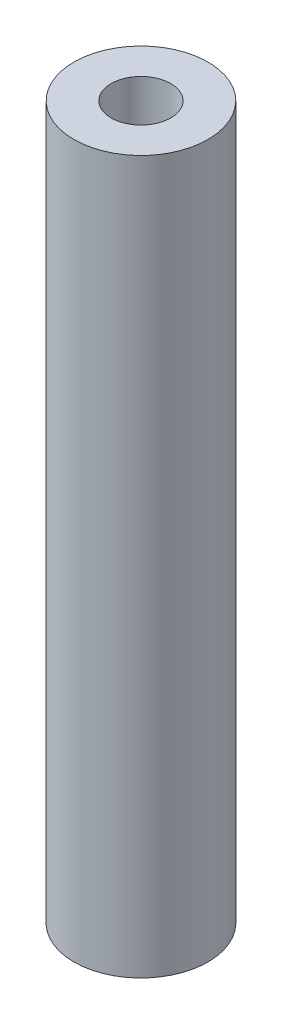
from build123d import *

# Parameters (mm, degrees)
SKETCH1_R           = 2.7
SKETCH1_R_2         = 1.2
BOSS_EXTRUDE1_DEPTH = 28.68


with BuildPart() as part:
    # Sketch1 → Boss-Extrude1 (new body)
    with BuildSketch(Plane(origin=(0, 0, 0), x_dir=(1, 0, 0), z_dir=(0, 1, 0))):
        with Locations(Location((0, 0, 0), (0, 0, 270))):
            Circle(SKETCH1_R)
        with Locations(Location((0, 0, 0), (0, 0, 270))):
            Circle(SKETCH1_R_2, mode=Mode.SUBTRACT)
    extrude(amount=BOSS_EXTRUDE1_DEPTH)


solid = part.part
